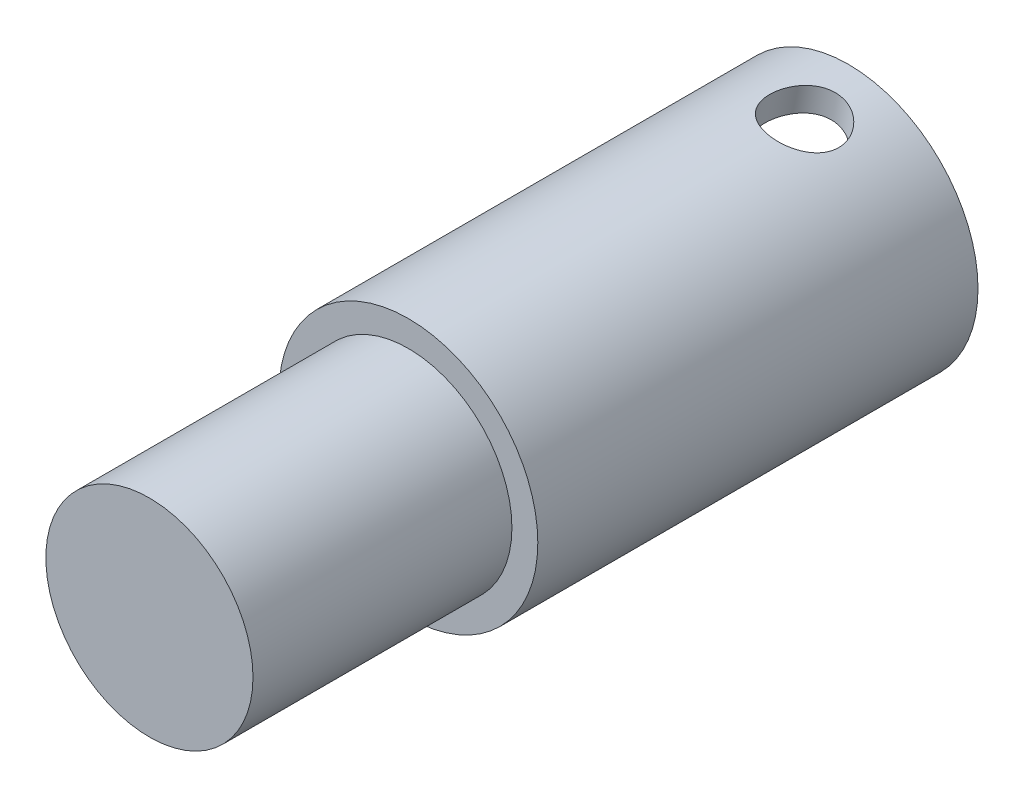
from build123d import *

# Parameters (mm, degrees)
BOSS_EXTRUDE1_DEPTH        = 13.5
BOSS_EXTRUDE1_DEPTH_BACK   = 13.5
SKETCH3_R                  = 5
SKETCH4_R                  = 5
SKETCH4_R_2                = 4
CUT_EXTRUDE1_DEPTH         = 10
CUT_EXTRUDE2_START         = -7.5
SKETCH5_R                  = 4
CUT_EXTRUDE2_DEPTH         = 7.5
SKETCH6_R                  = 3.1
CUT_EXTRUDE3_DEPTH         = 7
F_6_32_TAPPED_HOLE1_REACH  = 29.069
F_6_32_TAPPED_HOLE1_BORE_R = 1.35255


with BuildPart() as part:
    # Sketch3 → Boss-Extrude1 (new, two sides: drawn at the far end of the back side and taken through both)
    with BuildSketch(Plane.XY.offset(-BOSS_EXTRUDE1_DEPTH_BACK)):
        Circle(SKETCH3_R)
    extrude(amount=BOSS_EXTRUDE1_DEPTH + BOSS_EXTRUDE1_DEPTH_BACK)

    # Sketch4 → Cut-Extrude1 (cut)
    with BuildSketch(Plane.XY.offset(13.5)):
        Circle(SKETCH4_R)
        Circle(SKETCH4_R_2, mode=Mode.SUBTRACT)
    extrude(amount=-CUT_EXTRUDE1_DEPTH, mode=Mode.SUBTRACT)

    # Sketch5 → Cut-Extrude2 (cut)
    with BuildSketch(Plane(origin=(0, 0, -13.5), x_dir=(-1, 0, 0), z_dir=(0, 0, -1)).offset(CUT_EXTRUDE2_START)):
        with Locations(Location((0, 0, 0), (0, 0, 180))):
            Circle(SKETCH5_R)
    extrude(amount=CUT_EXTRUDE2_DEPTH, mode=Mode.SUBTRACT)

    # Sketch6 → Cut-Extrude3 (cut)
    with BuildSketch(Plane(origin=(0, 0, -6), x_dir=(-1, 0, 0), z_dir=(0, 0, -1))):
        Circle(SKETCH6_R)
    extrude(amount=-CUT_EXTRUDE3_DEPTH, mode=Mode.SUBTRACT)

    # #6-32 Tapped Hole1 bore (on position points) → #6-32 Tapped Hole1 (cut, up to next)
    with BuildSketch(Plane(origin=(0.817740869, 4.932676745, -11), x_dir=(0.986535349014, -0.163548173776, 0), z_dir=(0.163548173776, 0.986535349014, 0)), mode=Mode.PRIVATE) as f_6_32_tapped_hole1_sk1:
        Circle(F_6_32_TAPPED_HOLE1_BORE_R)
    f_6_32_tapped_hole1_tool1 = extrude(f_6_32_tapped_hole1_sk1.sketch, amount=-F_6_32_TAPPED_HOLE1_REACH, mode=Mode.PRIVATE) & part.part
    add(f_6_32_tapped_hole1_tool1.solids().sort_by_distance((0.817741, 4.932677, -11))[0], mode=Mode.SUBTRACT)


solid = part.part
